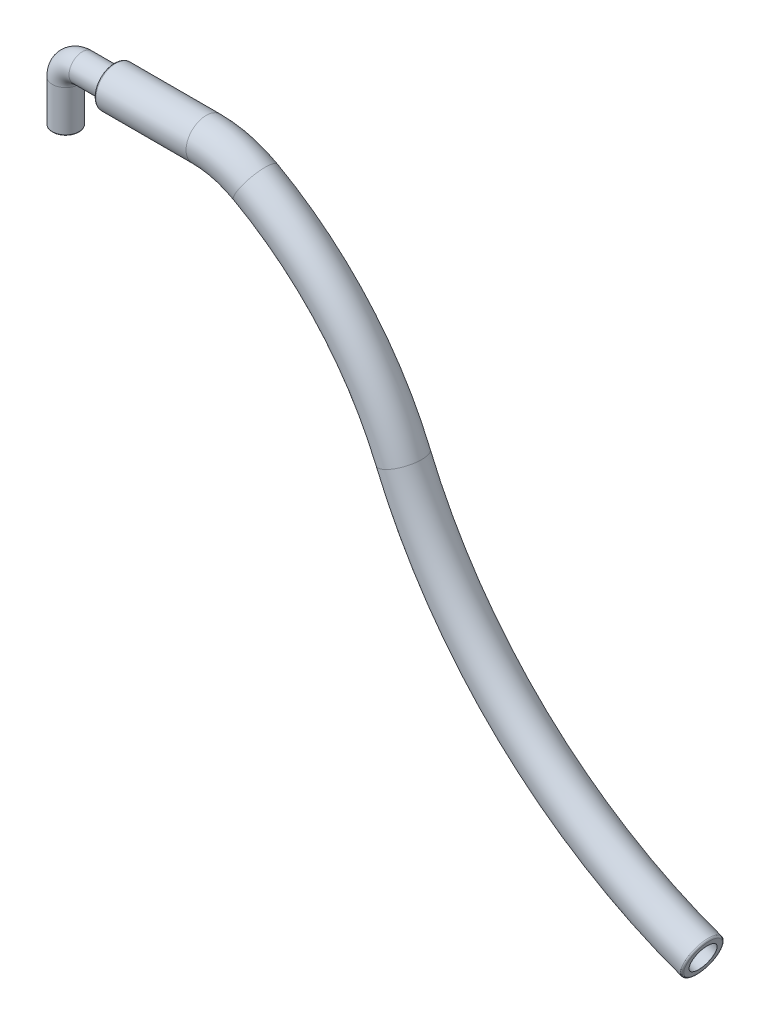
from build123d import *

# Parameters (mm, degrees)
CROQUIS2_R  = 8
VACIADO2_T  = -2
REDONDEO1_R = 0.5
CROQUIS7_R  = 12
VACIADO3_T  = -4
REDONDEO2_R = 1


with BuildPart() as part:
    # Barrer1: sweep along a path in Croquis1
    with BuildLine(Plane.XY) as barrer1_path:
        Line((0, -35), (0, -10))
        ThreePointArc((0, -10), (2.928932188, -2.928932188), (10, 0))
        Line((10, 0), (50, 0))
    # Croquis2 → Barrer1 (sweep)
    with BuildSketch(Plane.XZ.offset(35)):
        Circle(CROQUIS2_R)
    sweep(path=barrer1_path.line)

    # Vaciado2
    vaciado2_openings = [part.faces().sort_by_distance(p)[0] for p in [
        (50, 0, 0),
        (0, -35, 0),
    ]]
    offset(amount=VACIADO2_T, openings=vaciado2_openings, kind=Kind.INTERSECTION)

    # Redondeo1
    redondeo1_edges = [part.edges().sort_by_distance(p)[0] for p in [
        (-8, -35, 0),
        (50, 8, 0),
        (50, 6, 0),
        (-6, -35, 0),
    ]]
    fillet(redondeo1_edges, radius=REDONDEO1_R)


with BuildPart() as body_2:
    # Barrer2: sweep along a path in Croquis6
    with BuildLine(Plane.XY) as barrer2_path:
        Line((29.094637827, 0), (84.200597784, 0))
        ThreePointArc((84.200597784, 0), (99.495481145, -1.953506864), (113.80835393, -7.688602217))
        ThreePointArc((113.80835393, -7.688602217), (166.442146948, -49.767276178), (202.455875297, -106.722893462))
        ThreePointArc((202.455875297, -106.722893462), (274.416840741, -210.576986349), (382.25841167, -276.411997829))
    # Croquis7 → Barrer2 (sweep)
    with BuildSketch(Plane(origin=(29.094637827, 0, 0), x_dir=(0, 0, -1), z_dir=(1, 0, 0))):
        Circle(CROQUIS7_R)
    sweep(path=barrer2_path.line)

    # Vaciado3
    vaciado3_openings = [body_2.faces().sort_by_distance(p)[0] for p in [
        (382.25841167, -276.411997829, 0),
        (29.094637827, 0, 0),
    ]]
    offset(amount=VACIADO3_T, openings=vaciado3_openings, kind=Kind.INTERSECTION)

    # Redondeo2
    redondeo2_edges = [body_2.edges().sort_by_distance(p)[0] for p in [
        (29.094637827, 0, 12),
        (382.25841167, -276.411997829, 12),
    ]]
    fillet(redondeo2_edges, radius=REDONDEO2_R)


solid = Compound([part.part, body_2.part])
